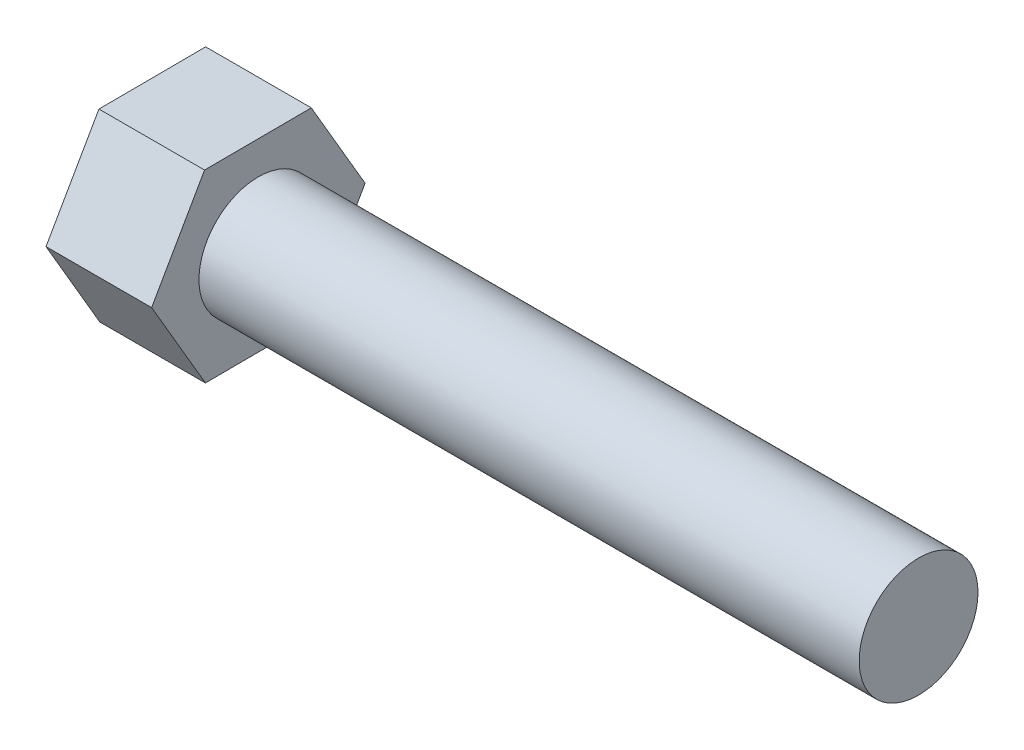
from build123d import *

# Parameters (mm, degrees)
BOSS_EXTRUDE1_DEPTH = 4
SKETCH3_R           = 2.25
BOSS_EXTRUDE2_DEPTH = 25


with BuildPart() as part:
    # Sketch2 → Boss-Extrude1 (new body)
    with BuildSketch(Plane(origin=(0, 0, 0), x_dir=(0, 0, -1), z_dir=(1, 0, 0))):
        Polygon((2.037408762, -3.49031501), (4.041405847, 0.019290241), (2.003997085, 3.509605251), (-2.037408762, 3.49031501), (-4.041405847, -0.019290241), (-2.003997085, -3.509605251), align=None)
    extrude(amount=BOSS_EXTRUDE1_DEPTH)

    # Sketch3 → Boss-Extrude2 (add)
    with BuildSketch(Plane(origin=(4, 0, 0), x_dir=(0, 0, -1), z_dir=(1, 0, 0))):
        Circle(SKETCH3_R)
    extrude(amount=BOSS_EXTRUDE2_DEPTH)


solid = part.part
